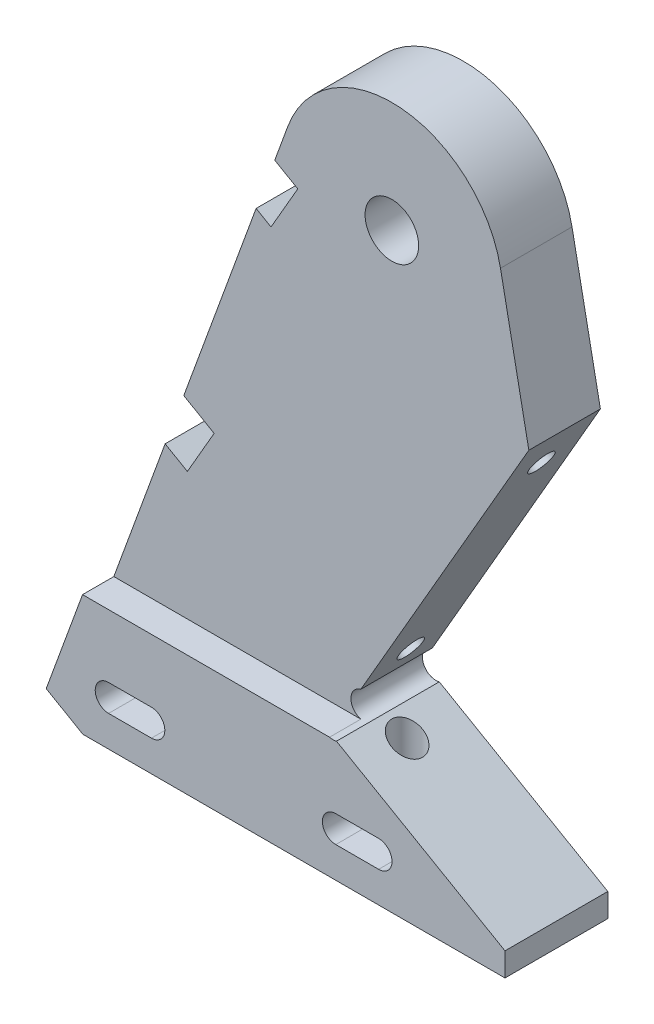
from build123d import *

# Parameters (mm, degrees)
MODEL_R                   = 3.175
BOSS_EXTRUDE1_DEPTH       = 8.4836
BOSS_EXTRUDE2_DEPTH       = 3.7084
F_4_CLEARANCE_HOLE3_D     = 2.9464
F_4_CLEARANCE_HOLE4_D     = 2.9464
CUT_EXTRUDE1_DEPTH        = 60.573404892
F_6_CLEARANCE_HOLE1_D     = 3.6576
F_6_CLEARANCE_HOLE1_DEPTH = 14.326172531
F_6_CLEARANCE_HOLE1_TIP   = 1.0988539


with BuildPart() as part:
    # Model → Boss-Extrude1 (new body)
    with BuildSketch(Plane.XY):
        with BuildLine():
            Line((30.032015577, -29.521189504), (30.032015577, -26.729824585))
            Line((30.032015577, -26.729824585), (10.04882977, -15.19252688))
            ThreePointArc((10.04882977, -15.19252688), (8.104547287, -14.069994865), (9.227079302, -12.125712382))
            Line((9.227079302, -12.125712382), (29.151876156, 22.3850481))
            Line((29.151876156, 22.3850481), (25.790540116, 39.397524407))
            ThreePointArc((25.790540116, 39.397524407), (13.922877184, 49.944916766), (0.570865514, 41.353485372))
            Line((0.570865514, 41.353485372), (-0.979565285, 37.104375313))
            Line((-0.979565285, 37.104375313), (1.753621818, 35.526369004))
            Line((1.753621818, 35.526369004), (-1.421378182, 30.02710769))
            Line((-1.421378182, 30.02710769), (-3.189468587, 31.047915161))
            Line((-3.189468587, 31.047915161), (-11.768069595, 7.537404491))
            Line((-11.768069595, 7.537404491), (-8.165923931, 5.457704722))
            Line((-8.165923931, 5.457704722), (-11.34077003, -0.041645446))
            Line((-11.34077003, -0.041645446), (-13.977972897, 1.480944339))
            Line((-13.977972897, 1.480944339), (-24.373743148, -27.00969967))
            Line((-24.373743148, -27.00969967), (-20.022585807, -29.521189504))
            Line((-20.022585807, -29.521189504), (30.032015577, -29.521189504))
        make_face()
        with Locations(Location((12.90743615, 36.852072417, 0), (0, 0, 180))):
            Circle(MODEL_R, mode=Mode.SUBTRACT)
    extrude(amount=BOSS_EXTRUDE1_DEPTH)

    # Sketch2 → Boss-Extrude2 (add)
    with BuildSketch(Plane.XY.offset(8.4836)):
        with BuildLine():
            Line((-20.062967478, -15.195589504), (9.227391231, -15.192610427))
            ThreePointArc((9.227391231, -15.192610427), (9.638115998, -15.246619623), (10.04882977, -15.19252688))
            Line((10.04882977, -15.19252688), (30.032015577, -26.729824585))
            Line((30.032015577, -26.729824585), (30.032015577, -29.521189504))
            Line((30.032015577, -29.521189504), (-20.022585807, -29.521189504))
            Line((-20.022585807, -29.521189504), (-24.373743148, -27.00969967))
            Line((-24.373743148, -27.00969967), (-20.062967478, -15.195589504))
        make_face()
    extrude(amount=BOSS_EXTRUDE2_DEPTH)

    # #4 Clearance Hole3 (through all)
    with Locations(Plane(origin=(-14.068152667, 8.12225173, 0), x_dir=(0, 0, 1), z_dir=(-0.8660254037844389, 0.4999999999999996, 0))):
        with Locations((4.2418, 28.46854897)):
            Hole(F_4_CLEARANCE_HOLE3_D / 2)

    # #4 Clearance Hole4 (through all)
    with Locations(Plane(origin=(-8.487819953, 4.900128422, 0), x_dir=(0, 0, 1), z_dir=(-0.8660393963332388, 0.49997576341134725, 0))):
        with Locations((4.2418, -2.53117675)):
            Hole(F_4_CLEARANCE_HOLE4_D / 2)

    # Sketch12 → Cut-Extrude1 (cut, through all)
    with BuildSketch(Plane(origin=(0, 0, 0), x_dir=(-1, 0, 0), z_dir=(0, 0, -1))):
        with BuildLine():
            Line((-15.046182511, -22.675889504), (-9.966182511, -22.675889504))
            ThreePointArc((-9.966182511, -22.675889504), (-8.378682511, -24.263389504), (-9.966182511, -25.850889504))
            Line((-9.966182511, -25.850889504), (-15.046182511, -25.850889504))
            ThreePointArc((-15.046182511, -25.850889504), (-16.633682511, -24.263389504), (-15.046182511, -22.675889504))
        make_face()
        with BuildLine():
            Line((11.894585807, -22.675889504), (16.974585807, -22.675889504))
            ThreePointArc((16.974585807, -22.675889504), (18.562085807, -24.263389504), (16.974585807, -25.850889504))
            Line((16.974585807, -25.850889504), (11.894585807, -25.850889504))
            ThreePointArc((11.894585807, -25.850889504), (10.307085807, -24.263389504), (11.894585807, -22.675889504))
        make_face()
    extrude(amount=-CUT_EXTRUDE1_DEPTH, mode=Mode.SUBTRACT)

    # #6 Clearance Hole1
    with Locations(Plane(origin=(0, -29.521189504, 0), x_dir=(-1, 0, 0), z_dir=(0, -1, 0))):
        with Locations((14.433829056, -6.27141583), (-12.506939307, -6.27141583)):
            Hole(F_6_CLEARANCE_HOLE1_D / 2, depth=F_6_CLEARANCE_HOLE1_DEPTH)
            with Locations((0, 0, -(F_6_CLEARANCE_HOLE1_DEPTH + F_6_CLEARANCE_HOLE1_TIP / 2))):  # 118° drill point
                Cone(0, F_6_CLEARANCE_HOLE1_D / 2, F_6_CLEARANCE_HOLE1_TIP, mode=Mode.SUBTRACT)


solid = part.part
